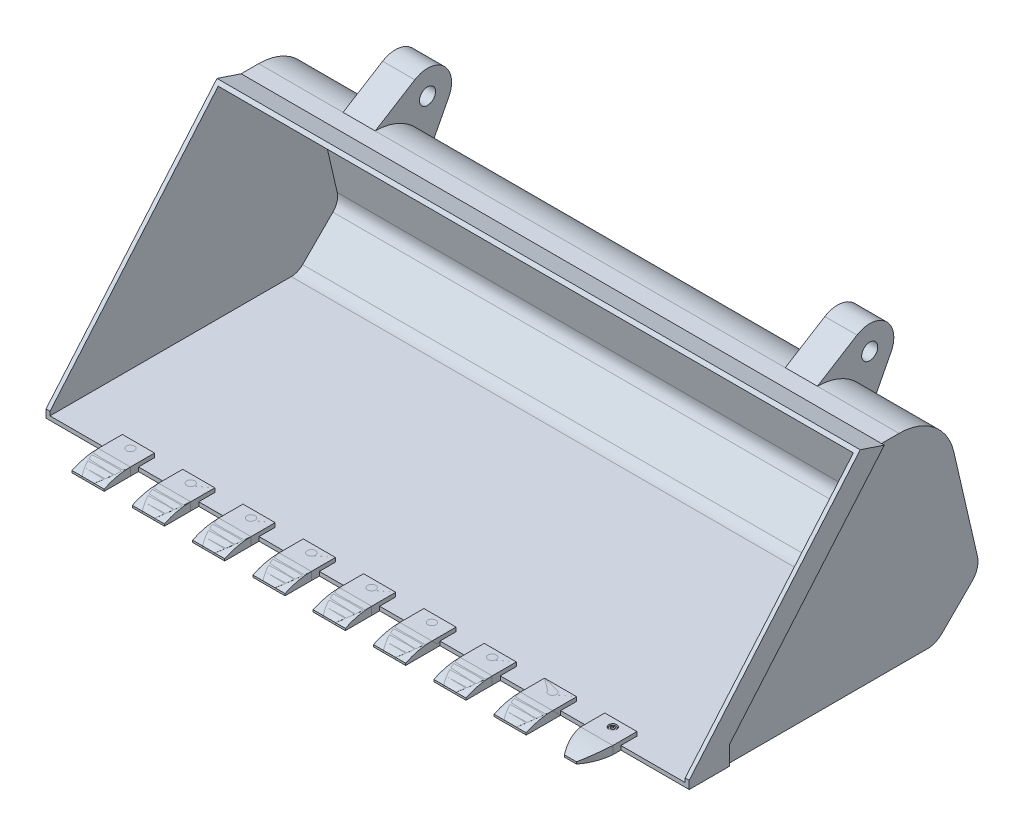
from build123d import *

# Parameters (mm, degrees)
BOSS_EXTRUDE1_DEPTH     = 800
CUT_EXTRUDE1_DEPTH      = 790
CUT_EXTRUDE2_DEPTH      = 7
SKETCH5_R               = 20
BOSS_EXTRUDE2_DEPTH     = 80
BOSS_EXTRUDE3_DEPTH     = 40
SKETCH7_R               = 6
CUT_EXTRUDE3_DEPTH      = 1060.582619024
SKETCH9_R               = 10
CUT_EXTRUDE4_DEPTH      = 10
SKETCH11_R              = 8.5
BOSS_EXTRUDE4_DEPTH     = 8
FILLET1_R               = 1
SKETCH12_R              = 6
BOSS_EXTRUDE5_DEPTH     = 8
CUT_EXTRUDE5_DEPTH      = 4
CUT_EXTRUDE8_DEPTH      = 1071.088458781
CUT_EXTRUDE8_DEPTH_BACK = 1071.088458781
LPATTERN2_COUNT         = 9
LPATTERN2_PITCH         = 150
LPATTERN1_COUNT         = 9
LPATTERN1_PITCH         = 150


with BuildPart() as part:
    # Sketch2 → Boss-Extrude1 (new, symmetric)
    with BuildSketch(Plane(origin=(0, 0, 0), x_dir=(0, 0, -1), z_dir=(1, 0, 0))):
        with BuildLine():
            Line((125.331807465, 519.349576998), (-300, 20))
            Line((-300, 20), (-300, 0))
            Line((-300, 0), (300, 0))
            ThreePointArc((300, 0), (319.134171618, 3.806023374), (335.355339059, 14.644660941))
            Line((335.355339059, 14.644660941), (410.714444745, 90.003766626))
            ThreePointArc((410.714444745, 90.003766626), (423.422190482, 111.577237895), (424.077608925, 136.606658403))
            Line((424.077608925, 136.606658403), (365.382588201, 390.842724606))
            ThreePointArc((365.382588201, 390.842724606), (316.122828261, 468.914718957), (228.970779132, 499.349576998))
            Line((228.970779132, 499.349576998), (185.331807465, 499.349576998))
            Line((185.331807465, 499.349576998), (125.331807465, 519.349576998))
        make_face()
    extrude(amount=BOSS_EXTRUDE1_DEPTH, both=True)

    # Sketch3 → Cut-Extrude1 (cut, symmetric)
    with BuildSketch(Plane(origin=(0, 0, 0), x_dir=(0, 0, -1), z_dir=(1, 0, 0))):
        with BuildLine():
            Line((118.338821698, 511.13964672), (-308.517716387, 10))
            Line((-308.517716387, 10), (-290, 10))
            Line((-290, 10), (300, 10))
            ThreePointArc((300, 10), (315.307337295, 13.0448187), (328.284271247, 21.715728753))
            Line((328.284271247, 21.715728753), (403.643376933, 97.074834438))
            ThreePointArc((403.643376933, 97.074834438), (413.809573523, 114.333611453), (414.333908277, 134.357147859))
            Line((414.333908277, 134.357147859), (355.638887554, 388.593214063))
            ThreePointArc((355.638887554, 388.593214063), (309.897681894, 461.088637389), (228.970779132, 489.349576998))
            Line((228.970779132, 489.349576998), (183.709030863, 489.349576998))
            Line((183.709030863, 489.349576998), (128.56986879, 507.729297689))
            Line((128.56986879, 507.729297689), (118.338821698, 511.13964672))
        make_face()
    extrude(amount=CUT_EXTRUDE1_DEPTH, both=True, mode=Mode.SUBTRACT)

    # Sketch4 → Cut-Extrude2 (cut)
    with BuildSketch(Plane(origin=(800, 0, 0), x_dir=(0, 0, -1), z_dir=(1, 0, 0))):
        with BuildLine():
            Line((228.970779132, 499.349576998), (185.331807465, 499.349576998))
            Line((185.331807465, 499.349576998), (-200, 46.960943737))
            Line((-200, 46.960943737), (-200, 0))
            Line((-200, 0), (300, 0))
            ThreePointArc((300, 0), (319.134171618, 3.806023374), (335.355339059, 14.644660941))
            Line((335.355339059, 14.644660941), (410.714444745, 90.003766626))
            ThreePointArc((410.714444745, 90.003766626), (423.422190482, 111.577237895), (424.077608925, 136.606658403))
            Line((424.077608925, 136.606658403), (365.382588201, 390.842724606))
            ThreePointArc((365.382588201, 390.842724606), (316.122828261, 468.914718957), (228.970779132, 499.349576998))
        make_face()
    extrude(amount=-CUT_EXTRUDE2_DEPTH, mode=Mode.SUBTRACT)

    # Sketch5 → Boss-Extrude2 (add)
    with BuildSketch(Plane(origin=(590, 0, 0), x_dir=(0, 0, -1), z_dir=(1, 0, 0))):
        with BuildLine():
            Line((228.970779132, 499.349576998), (327.355777872, 560.344593376))
            ThreePointArc((327.355777872, 560.344593376), (399.688914543, 553.41808558), (412.301450019, 481.857040871))
            Line((412.301450019, 481.857040871), (365.382588201, 390.842724606))
            ThreePointArc((365.382588201, 390.842724606), (316.122828261, 468.914718957), (228.970779132, 499.349576998))
        make_face()
        with Locations((358.970779132, 509.349576998)):
            Circle(SKETCH5_R, mode=Mode.SUBTRACT)
    boss_extrude2 = extrude(amount=-BOSS_EXTRUDE2_DEPTH)

    # Mirror1: Boss-Extrude2 across plane
    add(boss_extrude2.mirror(Plane(origin=(0, 0, 0), x_dir=(0, 0, 1), z_dir=(1, 0, 0))))


with BuildPart() as body_2:
    # Sketch6 → Boss-Extrude3 (new, symmetric)
    with BuildSketch(Plane(origin=(590, 0, 0), x_dir=(0, 0, -1), z_dir=(1, 0, 0))):
        with BuildLine():
            Line((-260, 20), (-260, 10))
            Line((-260, 10), (-300, 10))
            Line((-300, 10), (-300, 0))
            Line((-300, 0), (-385.383484153, 0))
            Line((-385.383484153, 0), (-385.383484153, 5))
            ThreePointArc((-385.383484153, 5), (-353.541019662, 16.201915172), (-320, 20))
            Line((-320, 20), (-260, 20))
        make_face()
    boss_extrude3 = extrude(amount=BOSS_EXTRUDE3_DEPTH, both=True)


with BuildPart() as cut_extrude3_tool:
    # Sketch7 → Cut-Extrude3 (new, through all)
    with BuildSketch(Plane(origin=(0, 20, 0), x_dir=(1, 0, 0), z_dir=(0, 1, 0))):
        with Locations(Location((590, -280, 0), (0, 0, 270))):
            Circle(SKETCH7_R)
    extrude(amount=-CUT_EXTRUDE3_DEPTH)


with BuildPart() as part_1:
    add(part.part)

    # Cut-Extrude3: cut by cut_extrude3_tool
    add(cut_extrude3_tool.part, mode=Mode.SUBTRACT)


with BuildPart() as body_2_1:
    add(body_2.part)

    # Cut-Extrude3: cut by cut_extrude3_tool
    add(cut_extrude3_tool.part, mode=Mode.SUBTRACT)

    # Sketch9 → Cut-Extrude4 (cut)
    with BuildSketch(Plane(origin=(0, 20, 0), x_dir=(1, 0, 0), z_dir=(0, 1, 0))):
        with Locations(Location((590, -280, 0), (0, 0, 270))):
            Circle(SKETCH9_R)
    extrude(amount=-CUT_EXTRUDE4_DEPTH, mode=Mode.SUBTRACT)

    # Sketch15 → Cut-Extrude8 (cut, two sides: drawn at the far end of the back side and taken through both)
    with BuildSketch(Plane.XZ.offset(-CUT_EXTRUDE8_DEPTH_BACK)):
        with BuildLine():
            ThreePointArc((550, 320), (558.896916341, 354.069415546), (575, 385.383484153))
            Line((575, 385.383484153), (550, 385.383484153))
            Line((550, 385.383484153), (550, 320))
        make_face()
        with BuildLine():
            Line((630, 385.383484153), (605, 385.383484153))
            ThreePointArc((605, 385.383484153), (622.378401524, 354.557045519), (630, 320))
            Line((630, 320), (630, 385.383484153))
        make_face()
    extrude(amount=CUT_EXTRUDE8_DEPTH + CUT_EXTRUDE8_DEPTH_BACK, mode=Mode.SUBTRACT)


with BuildPart() as body_3:
    # Sketch11 → Boss-Extrude4 (new body)
    with BuildSketch(Plane(origin=(0, 10, 0), x_dir=(1, 0, 0), z_dir=(0, 1, 0))):
        with Locations(Location((590, -280, 0), (0, 0, 270))):
            Circle(SKETCH11_R)
    extrude(amount=BOSS_EXTRUDE4_DEPTH)

    # Fillet1
    fillet1_edges = [body_3.edges().sort_by_distance(p)[0] for p in [
        (590, 18, 271.5),
    ]]
    fillet(fillet1_edges, radius=FILLET1_R)

    # Sketch13 → Cut-Extrude5 (cut)
    with BuildSketch(Plane(origin=(0, 18, 0), x_dir=(1, 0, 0), z_dir=(0, 1, 0))):
        Polygon((587.386863427, -284.83957821), (592.884629387, -284.682831761), (595.49776596, -279.843253551), (592.613136573, -275.16042179), (587.115370613, -275.317168239), (584.50223404, -280.156746449), align=None)
    extrude(amount=-CUT_EXTRUDE5_DEPTH, mode=Mode.SUBTRACT)


with BuildPart() as body_4:
    # Sketch12 → Boss-Extrude5 (new body)
    with BuildSketch(Plane(origin=(0, 10, 0), x_dir=(1, 0, 0), z_dir=(0, 1, 0))):
        with Locations(Location((590, -280, 0), (0, 0, 270))):
            Circle(SKETCH12_R)
    extrude(amount=-BOSS_EXTRUDE5_DEPTH)


with BuildPart() as lpattern2_1:
    # LPattern2: pattern copy
    add(body_3.part.moved(Location(Vector(-1, 0, 0) * (1 * LPATTERN2_PITCH))))


with BuildPart() as lpattern2_2:
    # LPattern2: pattern copy
    add(body_3.part.moved(Location(Vector(-1, 0, 0) * (2 * LPATTERN2_PITCH))))


with BuildPart() as lpattern2_3:
    # LPattern2: pattern copy
    add(body_3.part.moved(Location(Vector(-1, 0, 0) * (3 * LPATTERN2_PITCH))))


with BuildPart() as lpattern2_4:
    # LPattern2: pattern copy
    add(body_3.part.moved(Location(Vector(-1, 0, 0) * (4 * LPATTERN2_PITCH))))


with BuildPart() as lpattern2_5:
    # LPattern2: pattern copy
    add(body_3.part.moved(Location(Vector(-1, 0, 0) * (5 * LPATTERN2_PITCH))))


with BuildPart() as lpattern2_6:
    # LPattern2: pattern copy
    add(body_3.part.moved(Location(Vector(-1, 0, 0) * (6 * LPATTERN2_PITCH))))


with BuildPart() as lpattern2_7:
    # LPattern2: pattern copy
    add(body_3.part.moved(Location(Vector(-1, 0, 0) * (7 * LPATTERN2_PITCH))))


with BuildPart() as lpattern2_8:
    # LPattern2: pattern copy
    add(body_3.part.moved(Location(Vector(-1, 0, 0) * (8 * LPATTERN2_PITCH))))


with BuildPart() as lpattern2_9:
    # LPattern2: pattern copy
    add(body_2_1.part.moved(Location(Vector(-1, 0, 0) * (1 * LPATTERN2_PITCH))))


with BuildPart() as lpattern2_10:
    # LPattern2: pattern copy
    add(body_2_1.part.moved(Location(Vector(-1, 0, 0) * (2 * LPATTERN2_PITCH))))


with BuildPart() as lpattern2_11:
    # LPattern2: pattern copy
    add(body_2_1.part.moved(Location(Vector(-1, 0, 0) * (3 * LPATTERN2_PITCH))))


with BuildPart() as lpattern2_12:
    # LPattern2: pattern copy
    add(body_2_1.part.moved(Location(Vector(-1, 0, 0) * (4 * LPATTERN2_PITCH))))


with BuildPart() as lpattern2_13:
    # LPattern2: pattern copy
    add(body_2_1.part.moved(Location(Vector(-1, 0, 0) * (5 * LPATTERN2_PITCH))))


with BuildPart() as lpattern2_14:
    # LPattern2: pattern copy
    add(body_2_1.part.moved(Location(Vector(-1, 0, 0) * (6 * LPATTERN2_PITCH))))


with BuildPart() as lpattern2_15:
    # LPattern2: pattern copy
    add(body_2_1.part.moved(Location(Vector(-1, 0, 0) * (7 * LPATTERN2_PITCH))))


with BuildPart() as lpattern2_16:
    # LPattern2: pattern copy
    add(body_2_1.part.moved(Location(Vector(-1, 0, 0) * (8 * LPATTERN2_PITCH))))


with BuildPart() as lpattern1_1:
    # LPattern1: Boss-Extrude3 ×9
    with Locations(*[(-i * LPATTERN1_PITCH, 0, 0) for i in range(1, LPATTERN1_COUNT)]):
        add(boss_extrude3)


solid = Compound([part_1.part, body_2_1.part, body_3.part, body_4.part, lpattern2_1.part, lpattern2_2.part, lpattern2_3.part, lpattern2_4.part, lpattern2_5.part, lpattern2_6.part, lpattern2_7.part, lpattern2_8.part, lpattern2_9.part, lpattern2_10.part, lpattern2_11.part, lpattern2_12.part, lpattern2_13.part, lpattern2_14.part, lpattern2_15.part, lpattern2_16.part, lpattern1_1.part])
